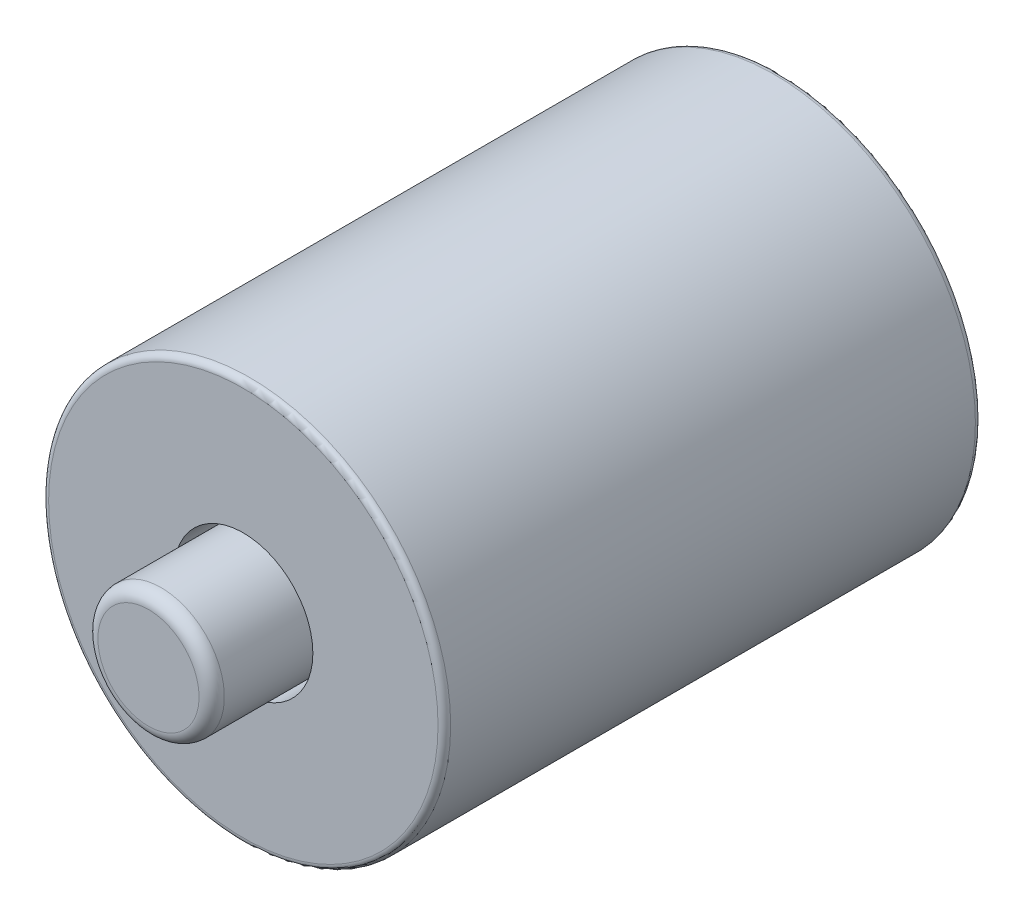
from build123d import *

# Parameters (mm, degrees)
SKETCH1_R               = 3.18
BOSS_EXTRUDE1_DEPTH     = 8.5
CUT_EXTRUDE1_DEPTH      = 10.616381856
CUT_EXTRUDE1_DEPTH_BACK = 10.616381856
SKETCH2_R               = 1.1
SKETCH3_R               = 1
BOSS_EXTRUDE2_DEPTH     = 10
FILLET1_R               = 0.2
FILLET2_R               = 0.1
FILLET3_R               = 0.1


with BuildPart() as part:
    # Sketch1 → Boss-Extrude1 (new body)
    with BuildSketch(Plane.XY):
        Circle(SKETCH1_R)
    extrude(amount=BOSS_EXTRUDE1_DEPTH)

    # Sketch2 → Cut-Extrude1 (cut, two sides: drawn at the far end of the back side and taken through both)
    with BuildSketch(Plane.XY.offset(8.5).offset(-CUT_EXTRUDE1_DEPTH_BACK)):
        Circle(SKETCH2_R)
    extrude(amount=CUT_EXTRUDE1_DEPTH + CUT_EXTRUDE1_DEPTH_BACK, mode=Mode.SUBTRACT)

    # Fillet2
    fillet2_edges = [part.edges().sort_by_distance(p)[0] for p in [
        (-3.18, 0, 8.5),
    ]]
    fillet(fillet2_edges, radius=FILLET2_R)

    # Fillet3
    fillet3_edges = [part.edges().sort_by_distance(p)[0] for p in [
        (-3.18, 0, 0),
    ]]
    fillet(fillet3_edges, radius=FILLET3_R)


with BuildPart() as body_2:
    # Sketch3 → Boss-Extrude2 (new body)
    with BuildSketch(Plane(origin=(0, 0, 0), x_dir=(-1, 0, 0), z_dir=(0, 0, -1))):
        Circle(SKETCH3_R)
    extrude(amount=-BOSS_EXTRUDE2_DEPTH)

    # Fillet1
    fillet1_edges = [body_2.edges().sort_by_distance(p)[0] for p in [
        (1, 0, 10),
    ]]
    fillet(fillet1_edges, radius=FILLET1_R)


solid = Compound([part.part, body_2.part])
